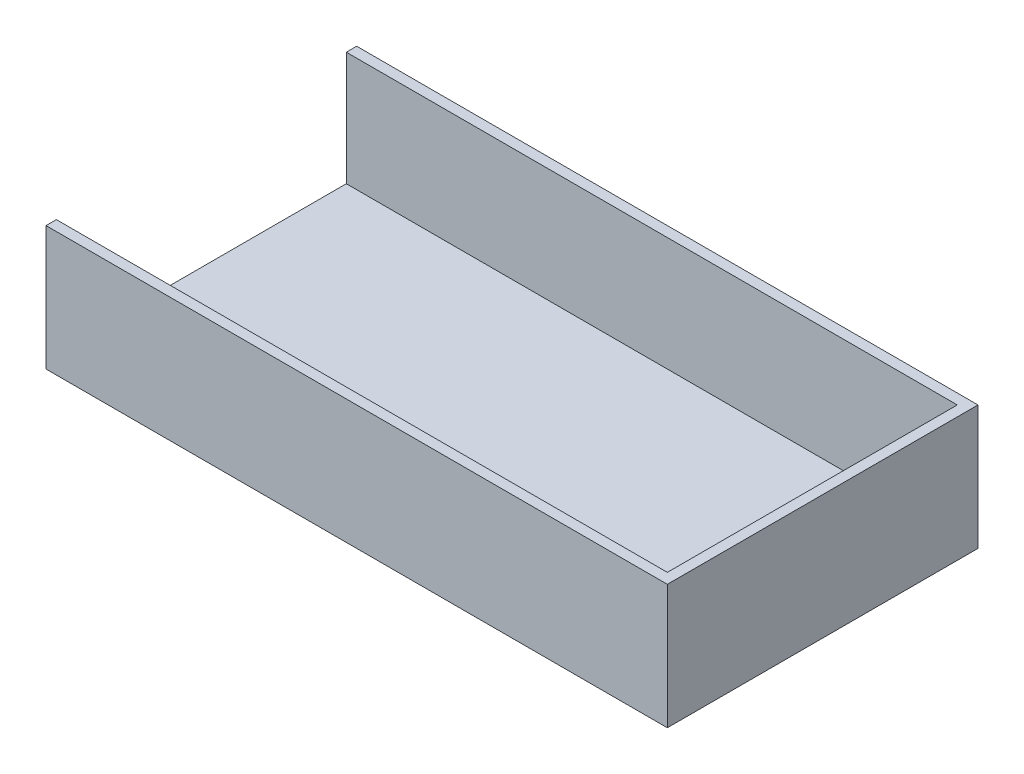
from build123d import *

# Parameters (mm, degrees)
BOSS_EXTRUDE1_DEPTH = 15
BOSS_EXTRUDE2_START = -15
SKETCH2_3_W         = 145
SKETCH2_3_H         = 70
SKETCH2_3_W_2       = 2.5
BOSS_EXTRUDE2_DEPTH = 2.5


with BuildPart() as part:
    # Sketch2 → Boss-Extrude1 (new, symmetric)
    with BuildSketch(Plane(origin=(0, 0, 0), x_dir=(1, 0, 0), z_dir=(0, 1, 0))):
        Polygon((-75, 35), (-72.5, 35), (72.5, 35), (72.5, -35), (-72.5, -35), (-75, -35), (-75, -37.5), (75, -37.5), (75, 37.5), (-75, 37.5), align=None)
    extrude(amount=BOSS_EXTRUDE1_DEPTH, both=True)

    # Sketch2<3> → Boss-Extrude2 (add)
    with BuildSketch(Plane(origin=(0, 0, 0), x_dir=(1, 0, 0), z_dir=(0, 1, 0)).offset(BOSS_EXTRUDE2_START)):
        Rectangle(SKETCH2_3_W, SKETCH2_3_H)
        with Locations((-73.75, 0)):
            Rectangle(SKETCH2_3_W_2, SKETCH2_3_H)
    extrude(amount=BOSS_EXTRUDE2_DEPTH)


solid = part.part
